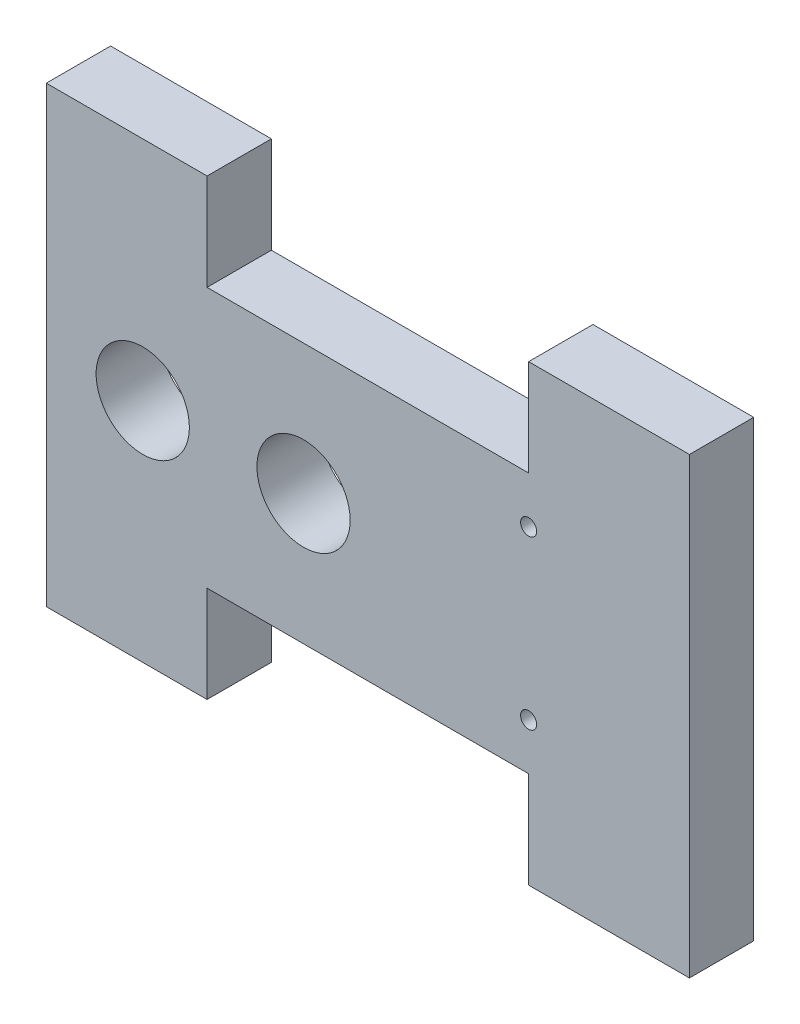
from build123d import *

# Parameters (mm, degrees)
BOSS_EXTRUDE1_DEPTH = 1.7
BOSS_EXTRUDE4_DEPTH = 0.3
SKETCH6_R           = 1.45
CUT_EXTRUDE1_DEPTH  = 2
SKETCH7_R           = 1.45
CUT_EXTRUDE2_DEPTH  = 2
SKETCH8_R           = 0.25
CUT_EXTRUDE3_DEPTH  = 2
SKETCH9_R           = 0.25
CUT_EXTRUDE4_DEPTH  = 2


with BuildPart() as part:
    # Sketch1 → Boss-Extrude1 (new body)
    with BuildSketch(Plane.XY):
        Polygon((-93.349083219, 17.192602894), (-83.349083219, 17.192602894), (-83.349083219, 20.192602894), (-78.349083219, 20.192602894), (-78.349083219, 6.092602894), (-83.349083219, 6.092602894), (-83.349083219, 9.092602894), (-93.349083219, 9.092602894), (-93.349083219, 6.092602894), (-98.349083219, 6.092602894), (-98.349083219, 20.192602894), (-93.349083219, 20.192602894), align=None)
    extrude(amount=BOSS_EXTRUDE1_DEPTH)

    # Sketch1<4> → Boss-Extrude4 (add)
    with BuildSketch(Plane.XY):
        Polygon((-93.349083219, 17.192602894), (-83.349083219, 17.192602894), (-83.349083219, 20.192602894), (-78.349083219, 20.192602894), (-78.349083219, 6.092602894), (-83.349083219, 6.092602894), (-83.349083219, 9.092602894), (-93.349083219, 9.092602894), (-93.349083219, 6.092602894), (-98.349083219, 6.092602894), (-98.349083219, 20.192602894), (-93.349083219, 20.192602894), align=None)
    extrude(amount=-BOSS_EXTRUDE4_DEPTH)

    # Sketch6 → Cut-Extrude1 (cut)
    with BuildSketch(Plane.XY.offset(1.7)):
        with Locations((-95.349083219, 13.142602894)):
            Circle(SKETCH6_R)
    extrude(amount=-CUT_EXTRUDE1_DEPTH, mode=Mode.SUBTRACT)

    # Sketch7 → Cut-Extrude2 (cut)
    with BuildSketch(Plane.XY.offset(1.7)):
        with Locations((-90.349083219, 13.142602894)):
            Circle(SKETCH7_R)
    extrude(amount=-CUT_EXTRUDE2_DEPTH, mode=Mode.SUBTRACT)

    # Sketch8 → Cut-Extrude3 (cut)
    with BuildSketch(Plane.XY.offset(1.7)):
        with Locations((-83.349083219, 15.742602894)):
            Circle(SKETCH8_R)
    extrude(amount=-CUT_EXTRUDE3_DEPTH, mode=Mode.SUBTRACT)

    # Sketch9 → Cut-Extrude4 (cut)
    with BuildSketch(Plane.XY.offset(1.7)):
        with Locations((-83.349083219, 10.542602894)):
            Circle(SKETCH9_R)
    extrude(amount=-CUT_EXTRUDE4_DEPTH, mode=Mode.SUBTRACT)


solid = part.part
